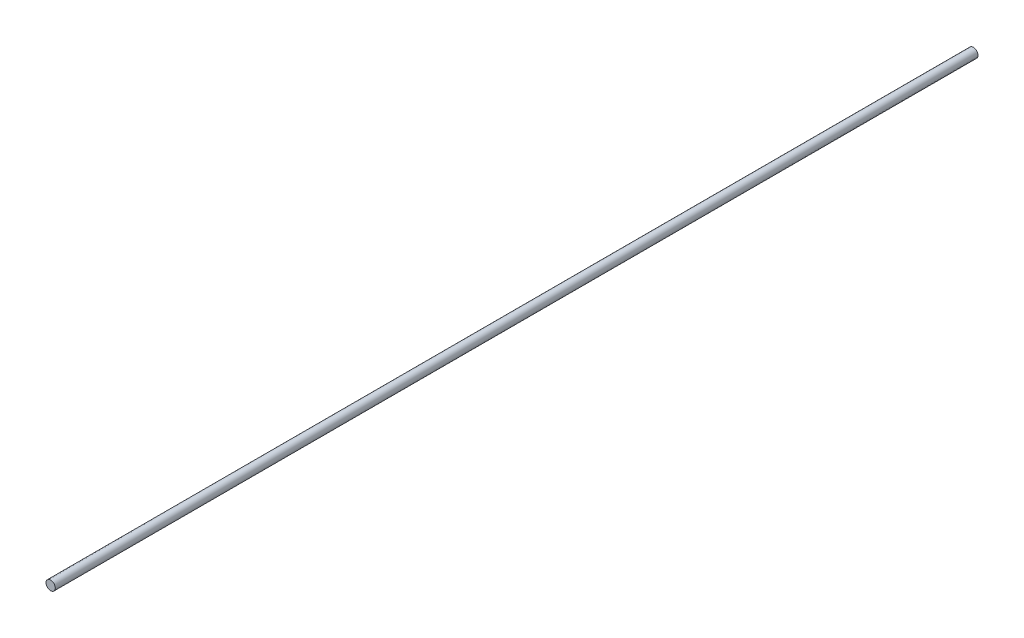
from build123d import *

# Parameters (mm, degrees)
SKETCH1_R           = 4
BOSS_EXTRUDE1_DEPTH = 397.5


with BuildPart() as part:
    # Sketch1 → Boss-Extrude1 (new, symmetric)
    with BuildSketch(Plane.XY):
        Circle(SKETCH1_R)
    extrude(amount=BOSS_EXTRUDE1_DEPTH, both=True)


solid = part.part
